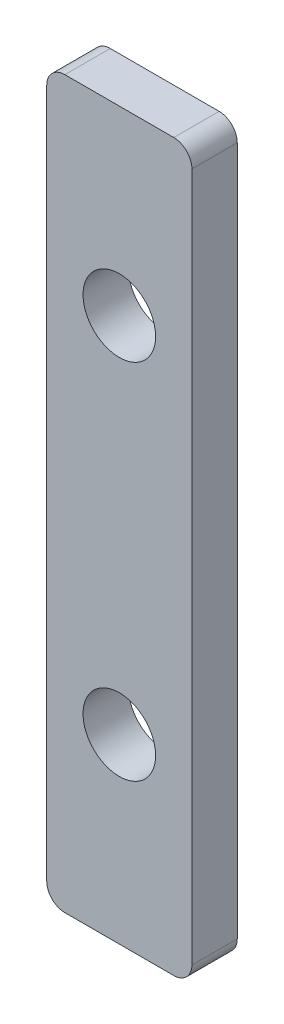
from build123d import *

# Parameters (mm, degrees)
SKETCH1_W           = 8
SKETCH1_H           = 40
SKETCH1_R           = 2
BOSS_EXTRUDE1_DEPTH = 2.5
FILLET1_R           = 1


with BuildPart() as part:
    # Sketch1 → Boss-Extrude1 (new body)
    with BuildSketch(Plane.XY):
        with Locations((4, 20)):
            Rectangle(SKETCH1_W, SKETCH1_H)
        with Locations((4, 10)):
            Circle(SKETCH1_R, mode=Mode.SUBTRACT)
        with Locations((4, 30)):
            Circle(SKETCH1_R, mode=Mode.SUBTRACT)
    extrude(amount=BOSS_EXTRUDE1_DEPTH)

    # Fillet1
    fillet1_edges = [part.edges().sort_by_distance(p)[0] for p in [
        (0, 40, 1.25),
        (8, 40, 1.25),
        (8, 0, 1.25),
        (0, 0, 1.25),
    ]]
    fillet(fillet1_edges, radius=FILLET1_R)


solid = part.part
